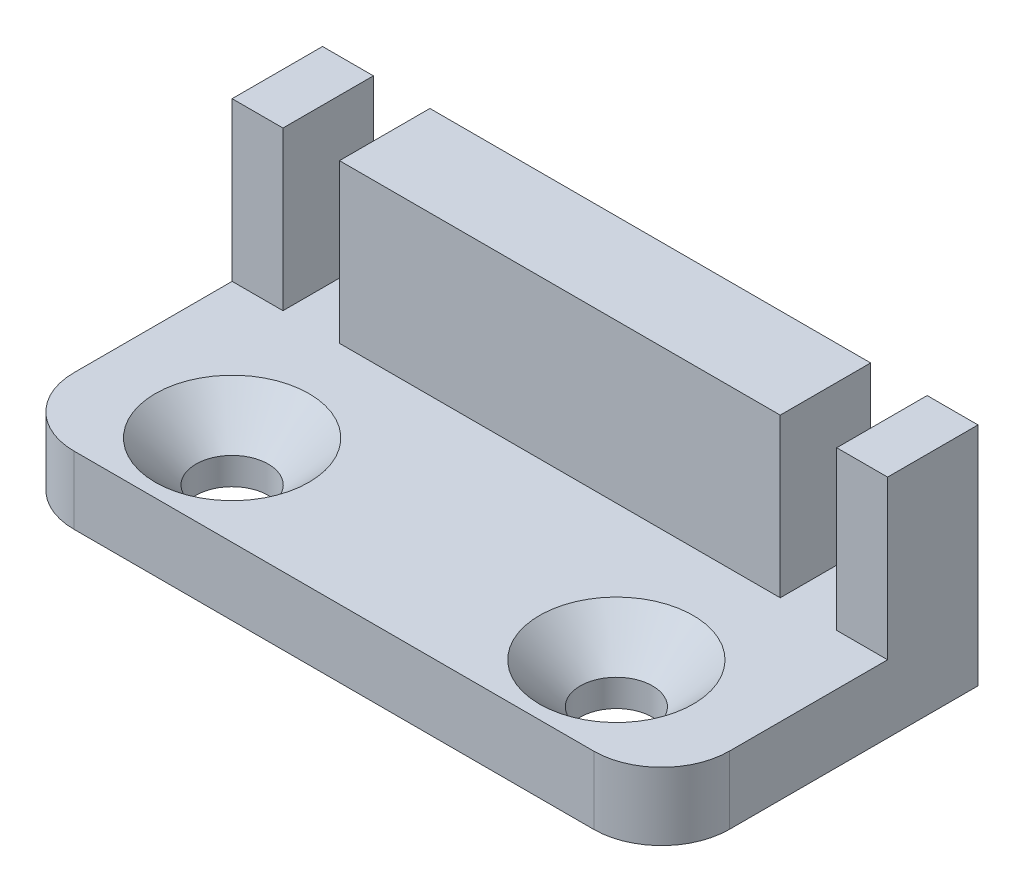
from build123d import *

# Parameters (mm, degrees)
SKETCH7_W           = 29
SKETCH7_H           = 10
BOSS_EXTRUDE5_DEPTH = 4
SKETCH8_W           = 29
SKETCH8_H           = 3
BOSS_EXTRUDE6_DEPTH = 10
SKETCH9_W           = 2.5
SKETCH9_H           = 4
CUT_EXTRUDE2_DEPTH  = 7
CUT_EXTRUDE3_REACH  = 34.955
SKETCH10_R          = 1.6
CHAMFER1_SIZE       = 1.8
FILLET1_R           = 3


with BuildPart() as part:
    # Sketch7 → Boss-Extrude5 (new body)
    with BuildSketch(Plane.XY):
        with Locations((14.5, 5)):
            Rectangle(SKETCH7_W, SKETCH7_H)
    extrude(amount=BOSS_EXTRUDE5_DEPTH)

    # Sketch8 → Boss-Extrude6 (add)
    with BuildSketch(Plane.XY.offset(4)):
        with Locations((14.5, 1.5)):
            Rectangle(SKETCH8_W, SKETCH8_H)
    extrude(amount=BOSS_EXTRUDE6_DEPTH)

    # Sketch9 → Cut-Extrude2 (cut)
    with BuildSketch(Plane(origin=(0, 10, 0), x_dir=(1, 0, 0), z_dir=(0, 1, 0))):
        with Locations((3.5, -2)):
            Rectangle(SKETCH9_W, SKETCH9_H)
        with Locations((25.5, -2)):
            Rectangle(SKETCH9_W, SKETCH9_H)
    extrude(amount=-CUT_EXTRUDE2_DEPTH, mode=Mode.SUBTRACT)

    # Sketch10 → Cut-Extrude3 (cut, up to next)
    with BuildSketch(Plane(origin=(0, 3, 0), x_dir=(1, 0, 0), z_dir=(0, 1, 0)), mode=Mode.PRIVATE) as cut_extrude3_sk1:
        with Locations(Location((6, -10, 0), (0, 0, 270))):
            Circle(SKETCH10_R)
    cut_extrude3_tool1 = extrude(cut_extrude3_sk1.sketch, amount=-CUT_EXTRUDE3_REACH, mode=Mode.PRIVATE) & part.part
    # Sketch10 → Cut-Extrude3 (cut, up to next)
    with BuildSketch(Plane(origin=(0, 3, 0), x_dir=(1, 0, 0), z_dir=(0, 1, 0)), mode=Mode.PRIVATE) as cut_extrude3_sk2:
        with Locations(Location((23, -10, 0), (0, 0, 270))):
            Circle(SKETCH10_R)
    cut_extrude3_tool2 = extrude(cut_extrude3_sk2.sketch, amount=-CUT_EXTRUDE3_REACH, mode=Mode.PRIVATE) & part.part
    add(cut_extrude3_tool1.solids().sort_by_distance((6, 3, 10))[0], mode=Mode.SUBTRACT)
    add(cut_extrude3_tool2.solids().sort_by_distance((23, 3, 10))[0], mode=Mode.SUBTRACT)

    # Chamfer1
    chamfer1_edges = [part.edges().sort_by_distance(p)[0] for p in [
        (6, 3, 8.4),
        (23, 3, 8.4),
    ]]
    chamfer(chamfer1_edges, length=CHAMFER1_SIZE)

    # Fillet1
    fillet1_edges = [part.edges().sort_by_distance(p)[0] for p in [
        (0, 1.5, 14),
        (29, 1.5, 14),
    ]]
    fillet(fillet1_edges, radius=FILLET1_R)


solid = part.part
